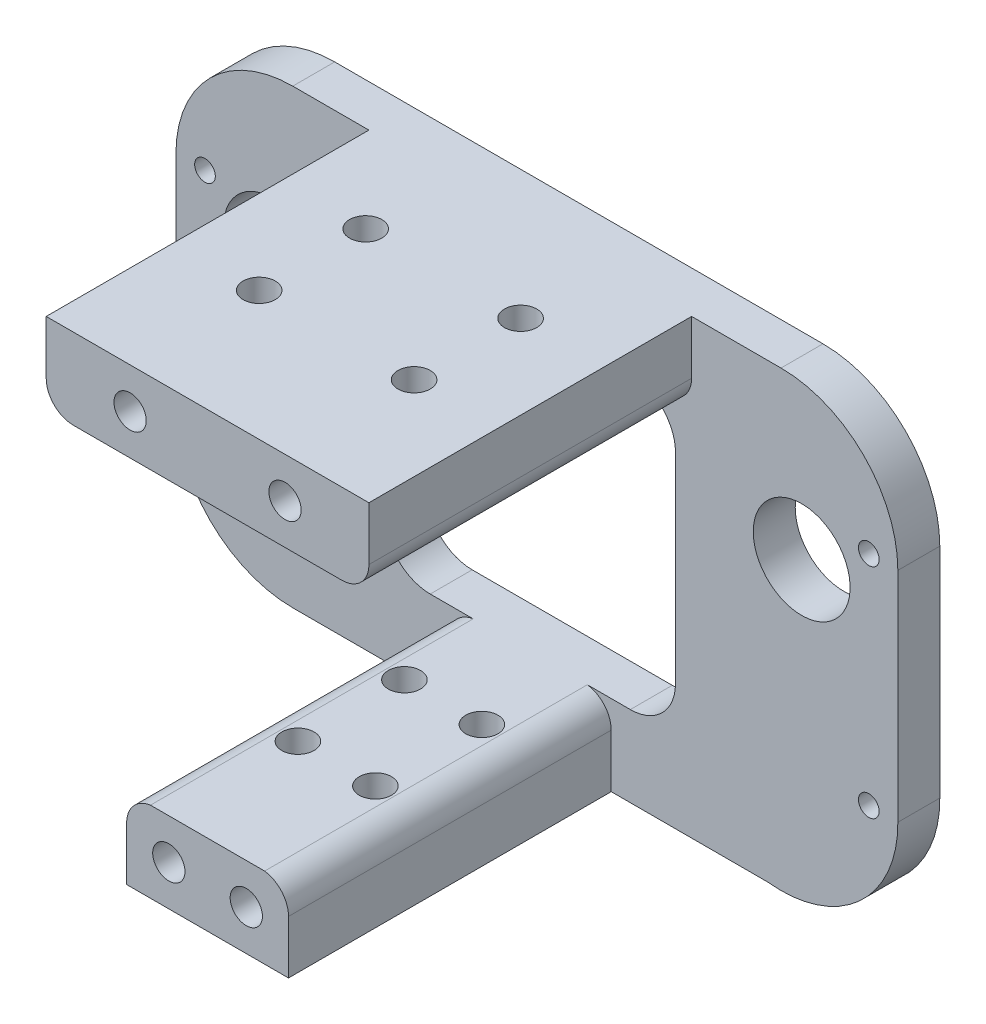
from build123d import *

# Parameters (mm, degrees)
SKETCH_1_R          = 1.6
SKETCH_1_R_2        = 7.5
EXTRUDE_1_DEPTH     = 6.5
EXTRUDE_2_DEPTH     = 50
SKETCH_3_R          = 2.5
CUT_EXTRUDE_1_DEPTH = 10
CUT_EXTRUDE_2_REACH = 108.546
SKETCH_5_R          = 2.5
CUT_EXTRUDE_3_REACH = 108.469
SKETCH_6_R          = 2.5


with BuildPart() as part:
    # 草图1 → 凸台-拉伸1 (new body)
    with BuildSketch(Plane.XY):
        with BuildLine():
            Line((-36.800051208, 35), (38.850303739, 35))
            ThreePointArc((38.850303739, 35), (51.648918374, 29.698640239), (56.950278135, 16.900025604))
            Line((56.950278135, 16.900025604), (56.950278135, -16.900025604))
            ThreePointArc((56.950278135, -16.900025604), (50.945911029, -30.48186799), (36.800051208, -35))
            Line((36.800051208, -35), (-36.800051208, -35))
            ThreePointArc((-36.800051208, -35), (-49.598665842, -29.698640239), (-54.900025604, -16.900025604))
            Line((-54.900025604, -16.900025604), (-54.900025604, 16.900025604))
            ThreePointArc((-54.900025604, 16.900025604), (-49.598665842, 29.698640239), (-36.800051208, 35))
        make_face()
        with Locations(Location((-50.400025604, 16.900025604, 0), (0, 0, 180))):
            Circle(SKETCH_1_R, mode=Mode.SUBTRACT)
        with Locations(Location((-40.000025604, 10.900025604, 0), (0, 0, 180))):
            Circle(SKETCH_1_R_2, mode=Mode.SUBTRACT)
        with Locations(Location((52.450278135, 16.900025604, 0), (0, 0, 180))):
            Circle(SKETCH_1_R, mode=Mode.SUBTRACT)
        with Locations(Location((42.050278135, 10.900025604, 0), (0, 0, 180))):
            Circle(SKETCH_1_R_2, mode=Mode.SUBTRACT)
        with Locations(Location((52.450278135, -16.900025604, 0), (0, 0, 180))):
            Circle(SKETCH_1_R, mode=Mode.SUBTRACT)
        with Locations(Location((-50.400025604, -16.900025604, 0), (0, 0, 180))):
            Circle(SKETCH_1_R, mode=Mode.SUBTRACT)
        with BuildLine():
            Line((-15.5, 22.5), (15.5, 22.5))
            ThreePointArc((15.5, 22.5), (20.449747468, 20.449747468), (22.5, 15.5))
            Line((22.5, 15.5), (22.5, -15.5))
            ThreePointArc((22.5, -15.5), (20.449747468, -20.449747468), (15.5, -22.5))
            Line((15.5, -22.5), (-15.5, -22.5))
            ThreePointArc((-15.5, -22.5), (-20.449747468, -20.449747468), (-22.5, -15.5))
            Line((-22.5, -15.5), (-22.5, 15.5))
            ThreePointArc((-22.5, 15.5), (-20.449747468, 20.449747468), (-15.5, 22.5))
        make_face(mode=Mode.SUBTRACT)
    extrude(amount=EXTRUDE_1_DEPTH)

    # 草图2 → 凸台-拉伸2 (add)
    with BuildSketch(Plane.XY.offset(6.5)):
        with BuildLine():
            Line((8.843450288, -22.5), (-8.843450288, -22.5))
            ThreePointArc((-8.843450288, -22.5), (-11.48607102, -23.92742014), (-12.539948379, -26.739948379))
            Line((-12.539948379, -26.739948379), (-12.539948379, -35))
            Line((-12.539948379, -35), (12.539948379, -35))
            Line((12.539948379, -35), (12.539948379, -26.739948379))
            ThreePointArc((12.539948379, -26.739948379), (11.48607102, -23.92742014), (8.843450288, -22.5))
        make_face()
        with BuildLine():
            Line((-20.8, 22.5), (20.8, 22.5))
            ThreePointArc((20.8, 22.5), (23.769848481, 23.730151519), (25, 26.7))
            Line((25, 26.7), (25, 35))
            Line((25, 35), (-25, 35))
            Line((-25, 35), (-25, 26.7))
            ThreePointArc((-25, 26.7), (-23.769848481, 23.730151519), (-20.8, 22.5))
        make_face()
    extrude(amount=EXTRUDE_2_DEPTH)

    # 草图3 → 切除-拉伸1 (cut)
    with BuildSketch(Plane.XY.offset(56.5)):
        with Locations((-12, 28.75)):
            Circle(SKETCH_3_R)
        with Locations((12, 28.75)):
            Circle(SKETCH_3_R)
        with Locations((-6, -28.75)):
            Circle(SKETCH_3_R)
        with Locations((6, -28.75)):
            Circle(SKETCH_3_R)
    extrude(amount=-CUT_EXTRUDE_1_DEPTH, mode=Mode.SUBTRACT)

    # 草图5 → 切除-拉伸2 (cut, up to next)
    with BuildSketch(Plane(origin=(0, 35, 0), x_dir=(1, 0, 0), z_dir=(0, 1, 0)), mode=Mode.PRIVATE) as cut_extrude_2_sk1:
        with Locations(Location((12, -20, 0), (0, 0, 180))):
            Circle(SKETCH_5_R)
    cut_extrude_2_tool1 = extrude(cut_extrude_2_sk1.sketch, amount=-CUT_EXTRUDE_2_REACH, mode=Mode.PRIVATE) & part.part
    # 草图5 → 切除-拉伸2 (cut, up to next)
    with BuildSketch(Plane(origin=(0, 35, 0), x_dir=(1, 0, 0), z_dir=(0, 1, 0)), mode=Mode.PRIVATE) as cut_extrude_2_sk2:
        with Locations((-12, -20)):
            Circle(SKETCH_5_R)
    cut_extrude_2_tool2 = extrude(cut_extrude_2_sk2.sketch, amount=-CUT_EXTRUDE_2_REACH, mode=Mode.PRIVATE) & part.part
    # 草图5 → 切除-拉伸2 (cut, up to next)
    with BuildSketch(Plane(origin=(0, 35, 0), x_dir=(1, 0, 0), z_dir=(0, 1, 0)), mode=Mode.PRIVATE) as cut_extrude_2_sk3:
        with Locations(Location((12, -36.5, 0), (0, 0, 180))):
            Circle(SKETCH_5_R)
    cut_extrude_2_tool3 = extrude(cut_extrude_2_sk3.sketch, amount=-CUT_EXTRUDE_2_REACH, mode=Mode.PRIVATE) & part.part
    # 草图5 → 切除-拉伸2 (cut, up to next)
    with BuildSketch(Plane(origin=(0, 35, 0), x_dir=(1, 0, 0), z_dir=(0, 1, 0)), mode=Mode.PRIVATE) as cut_extrude_2_sk4:
        with Locations((-12, -36.5)):
            Circle(SKETCH_5_R)
    cut_extrude_2_tool4 = extrude(cut_extrude_2_sk4.sketch, amount=-CUT_EXTRUDE_2_REACH, mode=Mode.PRIVATE) & part.part
    add(cut_extrude_2_tool1.solids().sort_by_distance((12, 35, 20))[0], mode=Mode.SUBTRACT)
    add(cut_extrude_2_tool2.solids().sort_by_distance((-12, 35, 20))[0], mode=Mode.SUBTRACT)
    add(cut_extrude_2_tool3.solids().sort_by_distance((12, 35, 36.5))[0], mode=Mode.SUBTRACT)
    add(cut_extrude_2_tool4.solids().sort_by_distance((-12, 35, 36.5))[0], mode=Mode.SUBTRACT)

    # 草图6 → 切除-拉伸3 (cut, up to next)
    with BuildSketch(Plane.XZ.offset(35), mode=Mode.PRIVATE) as cut_extrude_3_sk1:
        with Locations((-6, 20)):
            Circle(SKETCH_6_R)
    cut_extrude_3_tool1 = extrude(cut_extrude_3_sk1.sketch, amount=-CUT_EXTRUDE_3_REACH, mode=Mode.PRIVATE) & part.part
    # 草图6 → 切除-拉伸3 (cut, up to next)
    with BuildSketch(Plane.XZ.offset(35), mode=Mode.PRIVATE) as cut_extrude_3_sk2:
        with Locations((6, 20)):
            Circle(SKETCH_6_R)
    cut_extrude_3_tool2 = extrude(cut_extrude_3_sk2.sketch, amount=-CUT_EXTRUDE_3_REACH, mode=Mode.PRIVATE) & part.part
    # 草图6 → 切除-拉伸3 (cut, up to next)
    with BuildSketch(Plane.XZ.offset(35), mode=Mode.PRIVATE) as cut_extrude_3_sk3:
        with Locations((-6, 36.5)):
            Circle(SKETCH_6_R)
    cut_extrude_3_tool3 = extrude(cut_extrude_3_sk3.sketch, amount=-CUT_EXTRUDE_3_REACH, mode=Mode.PRIVATE) & part.part
    # 草图6 → 切除-拉伸3 (cut, up to next)
    with BuildSketch(Plane.XZ.offset(35), mode=Mode.PRIVATE) as cut_extrude_3_sk4:
        with Locations((6, 36.5)):
            Circle(SKETCH_6_R)
    cut_extrude_3_tool4 = extrude(cut_extrude_3_sk4.sketch, amount=-CUT_EXTRUDE_3_REACH, mode=Mode.PRIVATE) & part.part
    add(cut_extrude_3_tool1.solids().sort_by_distance((-6, -35, 20))[0], mode=Mode.SUBTRACT)
    add(cut_extrude_3_tool2.solids().sort_by_distance((6, -35, 20))[0], mode=Mode.SUBTRACT)
    add(cut_extrude_3_tool3.solids().sort_by_distance((-6, -35, 36.5))[0], mode=Mode.SUBTRACT)
    add(cut_extrude_3_tool4.solids().sort_by_distance((6, -35, 36.5))[0], mode=Mode.SUBTRACT)


solid = part.part
